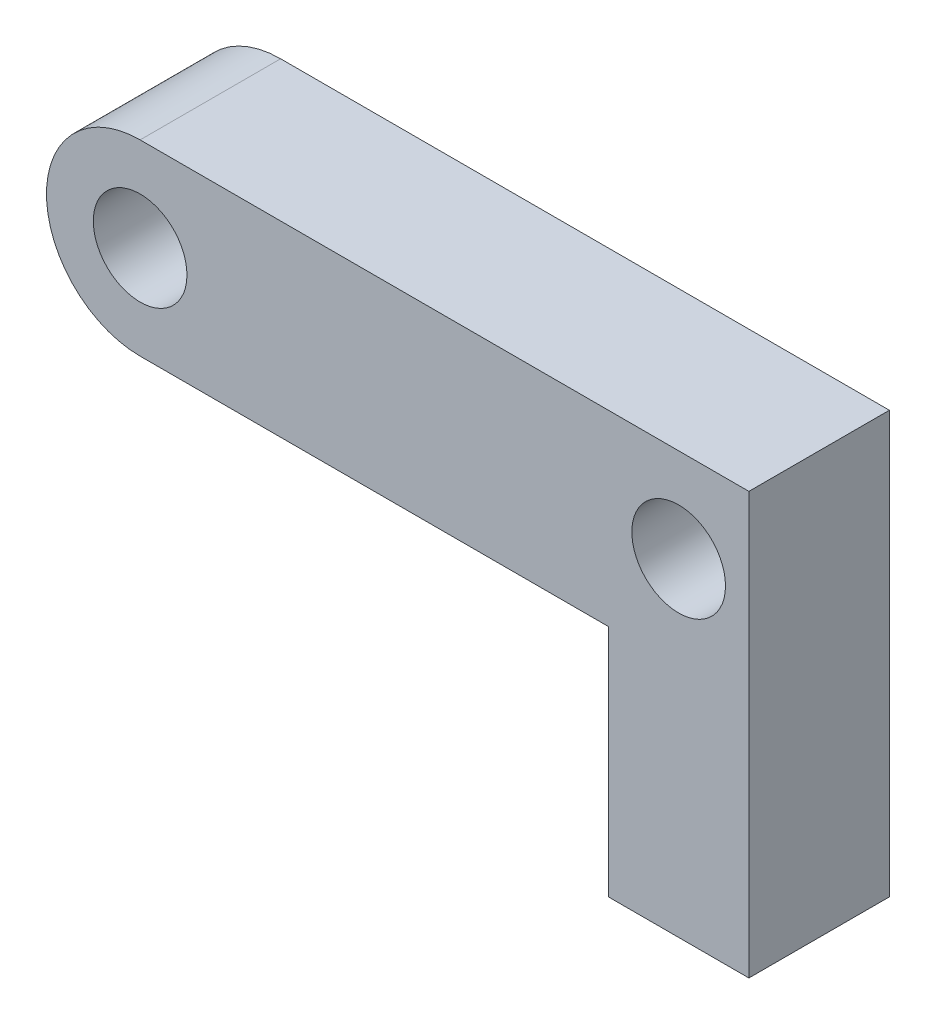
from build123d import *

# Parameters (mm, degrees)
BOSS_EXTRUDE1_DEPTH = 30
SKETCH2_R           = 8
CUT_EXTRUDE1_DEPTH  = 30
SKETCH3_R           = 10
CUT_EXTRUDE2_DEPTH  = 30


with BuildPart() as part:
    # Sketch1 → Boss-Extrude1 (new body)
    with BuildSketch(Plane(origin=(0, 0, 0), x_dir=(0, 1, 0), z_dir=(0, 0, 1))):
        with BuildLine():
            Line((-20, 0), (-20, -100))
            Line((-20, -100), (-70, -100))
            Line((-70, -100), (-70, -130))
            Line((-70, -130), (20, -130))
            Line((20, -130), (20, 0))
            ThreePointArc((20, 0), (0, 20), (-20, 0))
        make_face()
    extrude(amount=BOSS_EXTRUDE1_DEPTH)

    # Sketch2 → Cut-Extrude1 (cut)
    with BuildSketch(Plane.XZ.offset(70)):
        with Locations(Location((115, 15, 0), (0, 0, 270))):
            Circle(SKETCH2_R)
    extrude(amount=-CUT_EXTRUDE1_DEPTH, mode=Mode.SUBTRACT)

    # Sketch3 → Cut-Extrude2 (cut)
    with BuildSketch(Plane.XY.offset(30)):
        Circle(SKETCH3_R)
        with Locations((115, 0)):
            Circle(SKETCH3_R)
    extrude(amount=-CUT_EXTRUDE2_DEPTH, mode=Mode.SUBTRACT)


solid = part.part
